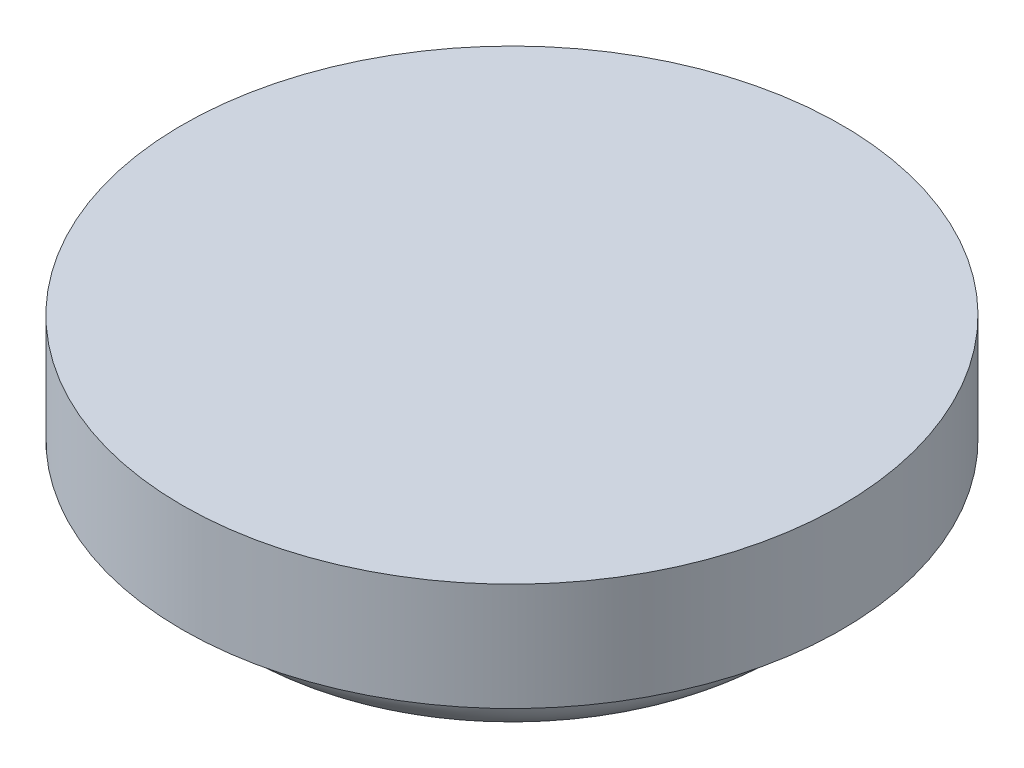
from build123d import *

# Parameters (mm, degrees)
SKETCH_1_R      = 6.45
EXTRUDE_1_DEPTH = 1.6
SKETCH_2_R      = 7.65
SKETCH_2_R_2    = 6.45
EXTRUDE_2_DEPTH = 2.5
FILLET_1_R      = 1


with BuildPart() as part:
    # Эскиз1 → Бобышка-Вытянуть1 (new body)
    with BuildSketch(Plane(origin=(0, 0, 0), x_dir=(1, 0, 0), z_dir=(0, 1, 0))):
        with Locations(Location((0, 0, 0), (0, 0, 270))):
            Circle(SKETCH_1_R)
    extrude(amount=EXTRUDE_1_DEPTH)

    # Эскиз2 → Бобышка-Вытянуть2 (add)
    # profile 1 of 2: a face of its own
    with BuildSketch(Plane(origin=(0, 1.6, 0), x_dir=(1, 0, 0), z_dir=(0, 1, 0))):
        with Locations(Location((0, 0, 0), (0, 0, 270))):
            Circle(SKETCH_2_R)
        with Locations(Location((0, 0, 0), (0, 0, 270))):
            Circle(SKETCH_2_R_2, mode=Mode.SUBTRACT)
    # profile 2 of 2: a face of its own
    with BuildSketch(Plane(origin=(0, 1.6, 0), x_dir=(1, 0, 0), z_dir=(0, 1, 0))):
        with Locations(Location((0, 0, 0), (0, 0, 270))):
            Circle(SKETCH_2_R_2)
    extrude(amount=EXTRUDE_2_DEPTH)

    # Скругление1
    fillet_1_edges = [part.edges().sort_by_distance(p)[0] for p in [
        (0, 0, -6.45),
    ]]
    fillet(fillet_1_edges, radius=FILLET_1_R)


solid = part.part
